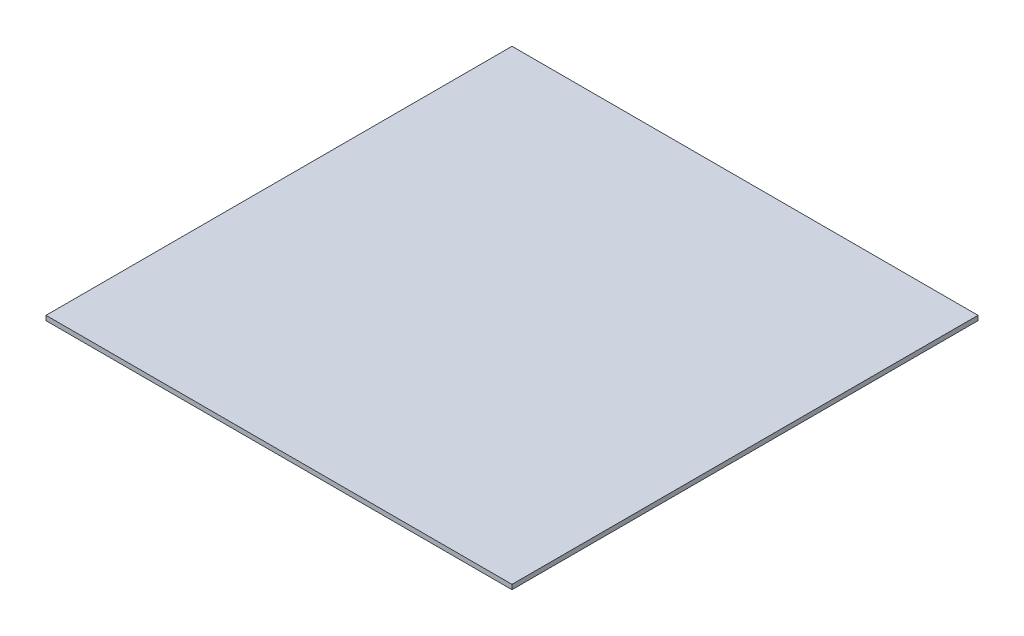
from build123d import *

# Parameters (mm, degrees)
SKETCH1_W           = 250
SKETCH1_H           = 250
BOSS_EXTRUDE1_DEPTH = 1.25


with BuildPart() as part:
    # Sketch1 → Boss-Extrude1 (new, symmetric)
    with BuildSketch(Plane(origin=(0, 0, 0), x_dir=(1, 0, 0), z_dir=(0, 1, 0))):
        Rectangle(SKETCH1_W, SKETCH1_H)
    extrude(amount=BOSS_EXTRUDE1_DEPTH, both=True)


solid = part.part
